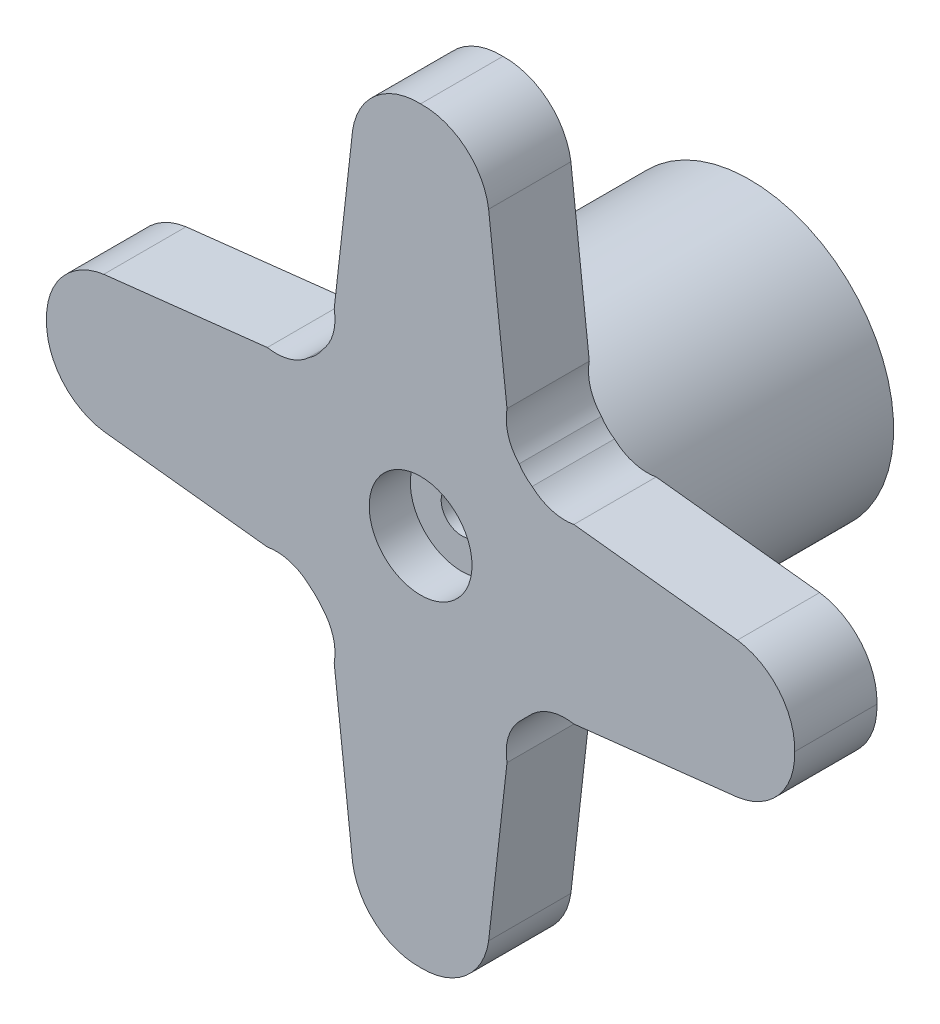
from build123d import *

# Parameters (mm, degrees)
BOSS_EXTRUDE1_DEPTH = 2
SKETCH2_R           = 3.5
SKETCH2_R_2         = 2.5
BOSS_EXTRUDE2_DEPTH = 6
SKETCH3_R           = 1.25
CUT_EXTRUDE1_DEPTH  = 1
SKETCH4_R           = 0.5
CUT_EXTRUDE2_DEPTH  = 1


with BuildPart() as part:
    # Sketch1 → Boss-Extrude1 (new body)
    with BuildSketch(Plane.XY):
        with BuildLine():
            Line((1.653818246, -7.701405378), (2.100322305, -3.726408024))
            ThreePointArc((2.100322305, -3.726408024), (2.127371286, -3.184526841), (2.395247592, -2.712712102))
            ThreePointArc((2.395247592, -2.712712102), (2.55393801, -2.55393801), (2.712712102, -2.395247592))
            ThreePointArc((2.712712102, -2.395247592), (3.184526841, -2.127371286), (3.726408024, -2.100322305))
            Line((3.726408024, -2.100322305), (7.701405378, -1.653818246))
            ThreePointArc((7.701405378, -1.653818246), (8.713646486, -1.093206236), (9.092879943, 0))
            ThreePointArc((9.092879943, 0), (8.713646486, 1.093206236), (7.701405378, 1.653818246))
            Line((7.701405378, 1.653818246), (3.726408024, 2.100322305))
            ThreePointArc((3.726408024, 2.100322305), (3.184526841, 2.127371286), (2.712712102, 2.395247592))
            ThreePointArc((2.712712102, 2.395247592), (2.537508652, 2.537508652), (2.395247592, 2.712712102))
            ThreePointArc((2.395247592, 2.712712102), (2.127371286, 3.184526841), (2.100322305, 3.726408024))
            Line((2.100322305, 3.726408024), (1.653818246, 7.701405378))
            ThreePointArc((1.653818246, 7.701405378), (1.093206236, 8.713646486), (0, 9.092879943))
            ThreePointArc((0, 9.092879943), (-1.093206236, 8.713646486), (-1.653818246, 7.701405378))
            Line((-1.653818246, 7.701405378), (-2.100322305, 3.726408024))
            ThreePointArc((-2.100322305, 3.726408024), (-2.127371286, 3.184526841), (-2.395247592, 2.712712102))
            ThreePointArc((-2.395247592, 2.712712102), (-2.537508652, 2.537508652), (-2.712712102, 2.395247592))
            ThreePointArc((-2.712712102, 2.395247592), (-3.184526841, 2.127371286), (-3.726408024, 2.100322305))
            Line((-3.726408024, 2.100322305), (-7.701405378, 1.653818246))
            ThreePointArc((-7.701405378, 1.653818246), (-8.713646486, 1.093206236), (-9.092879943, 0))
            ThreePointArc((-9.092879943, 0), (-8.713646486, -1.093206236), (-7.701405378, -1.653818246))
            Line((-7.701405378, -1.653818246), (-3.726408024, -2.100322305))
            ThreePointArc((-3.726408024, -2.100322305), (-3.184526841, -2.127371286), (-2.712712102, -2.395247592))
            ThreePointArc((-2.712712102, -2.395247592), (-2.542453575, -2.542453575), (-2.395247592, -2.712712102))
            ThreePointArc((-2.395247592, -2.712712102), (-2.127371286, -3.184526841), (-2.100322305, -3.726408024))
            Line((-2.100322305, -3.726408024), (-1.653818246, -7.701405378))
            ThreePointArc((-1.653818246, -7.701405378), (-1.093206236, -8.713646486), (0, -9.092879943))
            ThreePointArc((0, -9.092879943), (1.093206236, -8.713646486), (1.653818246, -7.701405378))
        make_face()
    extrude(amount=BOSS_EXTRUDE1_DEPTH)

    # Sketch2 → Boss-Extrude2 (add)
    with BuildSketch(Plane(origin=(0, 0, 0), x_dir=(-1, 0, 0), z_dir=(0, 0, -1))):
        Circle(SKETCH2_R)
        Circle(SKETCH2_R_2, mode=Mode.SUBTRACT)
    extrude(amount=BOSS_EXTRUDE2_DEPTH)

    # Sketch3 → Cut-Extrude1 (cut)
    with BuildSketch(Plane.XY.offset(2)):
        Circle(SKETCH3_R)
    extrude(amount=-CUT_EXTRUDE1_DEPTH, mode=Mode.SUBTRACT)

    # Sketch4 → Cut-Extrude2 (cut)
    with BuildSketch(Plane.XY.offset(1)):
        Circle(SKETCH4_R)
    extrude(amount=-CUT_EXTRUDE2_DEPTH, mode=Mode.SUBTRACT)


solid = part.part
